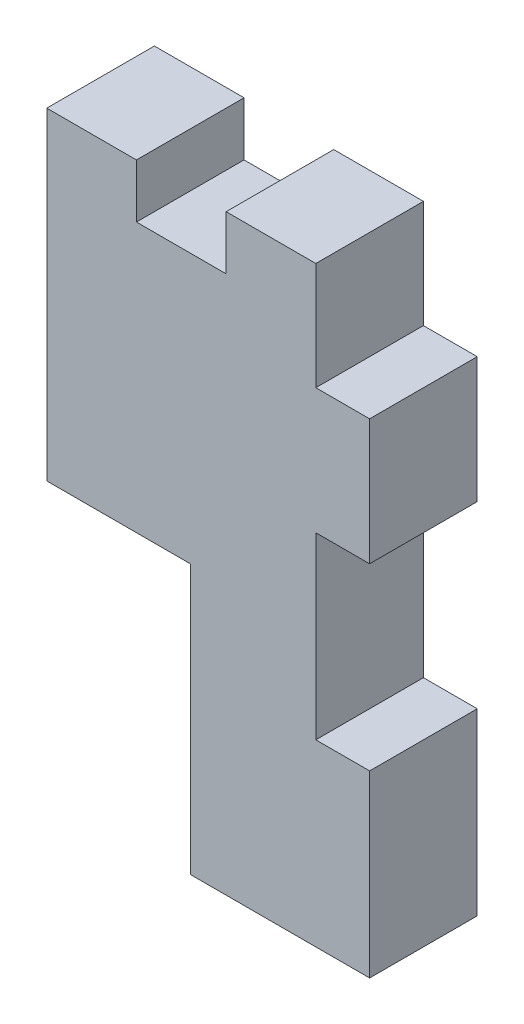
from build123d import *

# Parameters (mm, degrees)
BOSS_EXTRU_1_DEPTH      = 3
ESQUISSE2_W             = 3
ESQUISSE2_H             = 3
ENL_V_MAT_EXTRU_1_DEPTH = 6


with BuildPart() as part:
    # Esquisse1 → Boss.-Extru.1 (new, symmetric)
    with BuildSketch(Plane.XY):
        Polygon((-7, 0), (3, 0), (3, 10), (0, 10), (0, 20), (3, 20), (3, 30), (0, 30), (0, 33), (-5, 33), (-5, 30), (-10, 30), (-10, 33), (-15, 33), (-15, 15), (-7, 15), align=None)
    extrude(amount=BOSS_EXTRU_1_DEPTH, both=True)

    # Esquisse2 → Enlèv. mat.-Extru.1 (cut)
    with BuildSketch(Plane.XY.offset(3)):
        with Locations((1.5, 28.5)):
            Rectangle(ESQUISSE2_W, ESQUISSE2_H)
    extrude(amount=-ENL_V_MAT_EXTRU_1_DEPTH, mode=Mode.SUBTRACT)


solid = part.part
